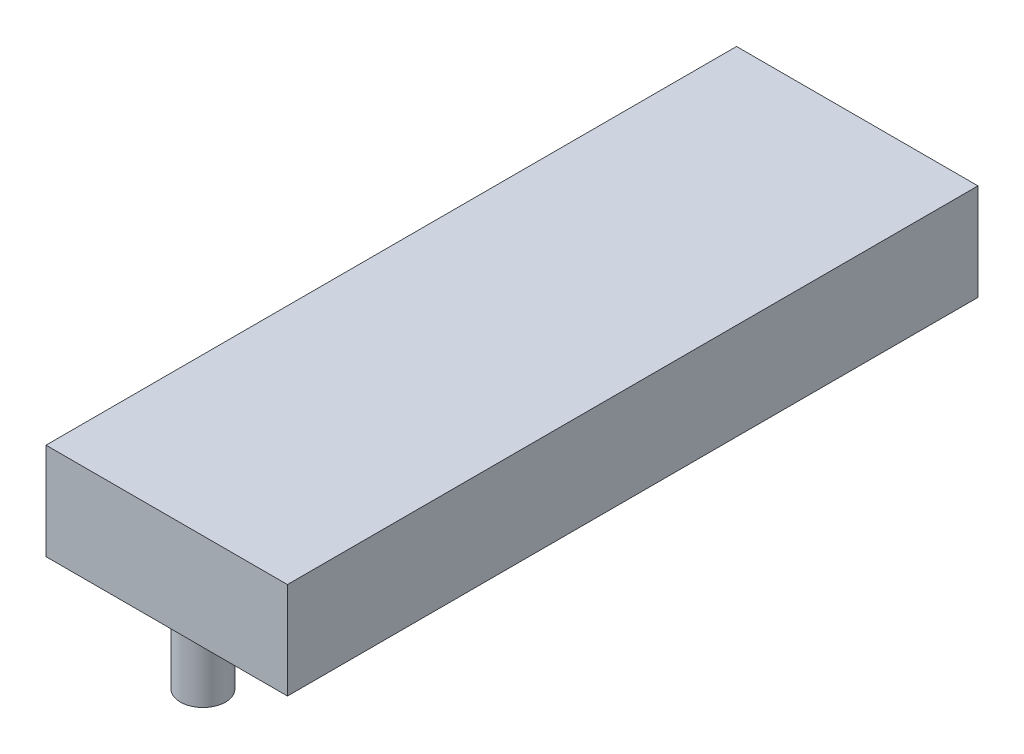
from build123d import *

# Parameters (mm, degrees)
SKETCH1_W           = 10
SKETCH1_H           = 28.6
BOSS_EXTRUDE1_DEPTH = 4
SKETCH2_R           = 0.935
BOSS_EXTRUDE2_DEPTH = 3


with BuildPart() as part:
    # Sketch1 → Boss-Extrude1 (new body)
    with BuildSketch(Plane(origin=(0, 0, 0), x_dir=(1, 0, 0), z_dir=(0, 1, 0))):
        Rectangle(SKETCH1_W, SKETCH1_H)
    extrude(amount=BOSS_EXTRUDE1_DEPTH)

    # Sketch2 → Boss-Extrude2 (add)
    with BuildSketch(Plane.XZ):
        with Locations(Location((0, 12.8, 0), (0, 0, 270))):
            Circle(SKETCH2_R)
        with Locations(Location((0, -12.8, 0), (0, 0, 90))):
            Circle(SKETCH2_R)
    extrude(amount=BOSS_EXTRUDE2_DEPTH)


solid = part.part
